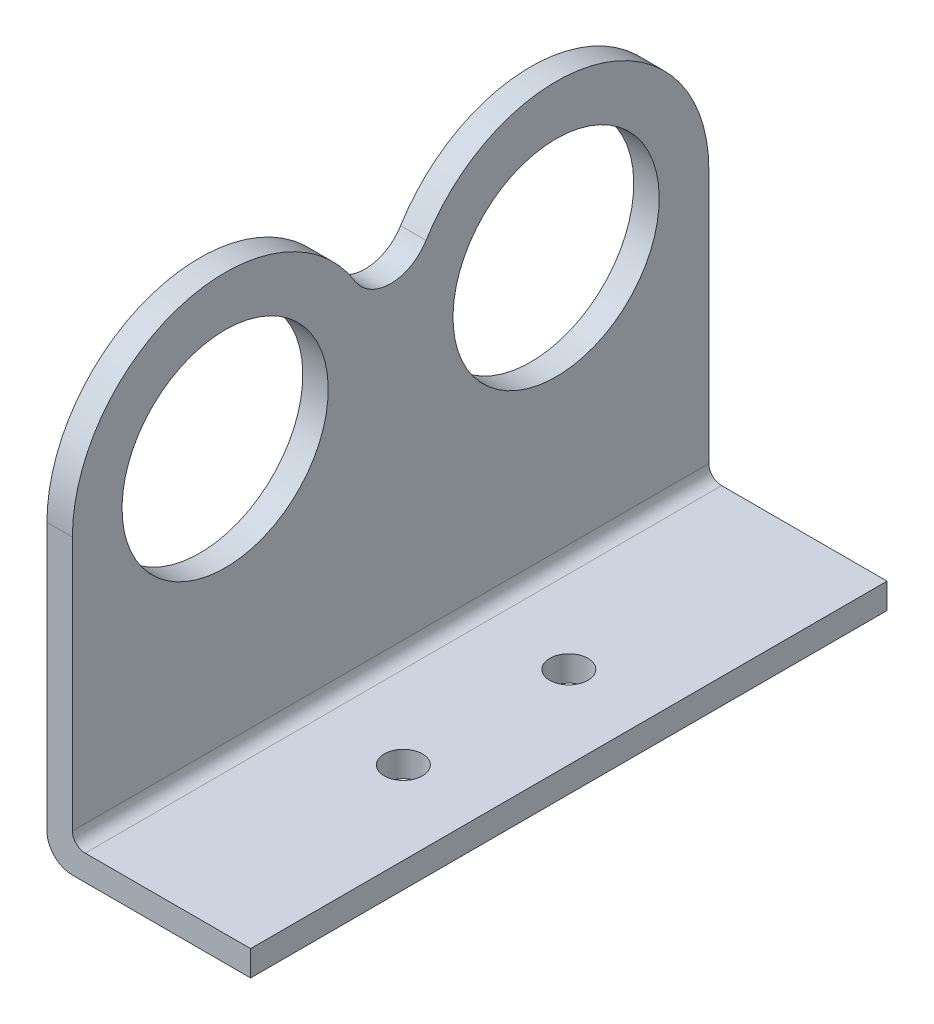
from build123d import *

# Parameters (mm, degrees)
BOSS_EXTRUDE1_DEPTH = 50
SKETCH2_R           = 1.5
CUT_EXTRUDE1_DEPTH  = 50
SKETCH3_R           = 8.1
CUT_EXTRUDE2_DEPTH  = 50


with BuildPart() as part:
    # Sketch1 → Boss-Extrude1 (new body)
    with BuildSketch(Plane.XY):
        with BuildLine():
            Line((0, 35), (0, 2))
            ThreePointArc((0, 2), (0.585786438, 0.585786438), (2, 0))
            Line((2, 0), (16, 0))
            Line((16, 0), (16, 2))
            Line((16, 2), (3, 2))
            ThreePointArc((3, 2), (2.292893219, 2.292893219), (2, 3))
            Line((2, 3), (2, 35))
            Line((2, 35), (0, 35))
        make_face()
    extrude(amount=BOSS_EXTRUDE1_DEPTH)

    # Sketch2 → Cut-Extrude1 (cut)
    with BuildSketch(Plane(origin=(0, 2, 0), x_dir=(1, 0, 0), z_dir=(0, 1, 0))):
        with Locations(Location((9.5, -18.5, 0), (0, 0, 270))):
            Circle(SKETCH2_R)
        with Locations(Location((9.5, -31.5, 0), (0, 0, 270))):
            Circle(SKETCH2_R)
    extrude(amount=-CUT_EXTRUDE1_DEPTH, mode=Mode.SUBTRACT)

    # Sketch3 → Cut-Extrude2 (cut)
    with BuildSketch(Plane(origin=(2, 0, 0), x_dir=(0, 0, -1), z_dir=(1, 0, 0))):
        with Locations(Location((-12, 23, 0), (0, 0, 90))):
            Circle(SKETCH3_R)
        with Locations(Location((-38, 23, 0), (0, 0, 90))):
            Circle(SKETCH3_R)
        with BuildLine():
            ThreePointArc((-50, 23), (-46.485281374, 31.485281374), (-38, 35))
            Line((-38, 35), (-50, 35))
            Line((-50, 35), (-50, 23))
        make_face()
        with BuildLine():
            ThreePointArc((-22.2198998, 29.289169108), (-17.8536301, 33.475448184), (-12, 35))
            Line((-12, 35), (-38, 35))
            ThreePointArc((-38, 35), (-32.1463699, 33.475448184), (-27.7801002, 29.289169108))
            ThreePointArc((-27.7801002, 29.289169108), (-25, 27.735662478), (-22.2198998, 29.289169108))
        make_face()
        with BuildLine():
            Line((0, 35), (-12, 35))
            ThreePointArc((-12, 35), (-3.514718626, 31.485281374), (0, 23))
            Line((0, 23), (0, 35))
        make_face()
    extrude(amount=-CUT_EXTRUDE2_DEPTH, mode=Mode.SUBTRACT)


solid = part.part
